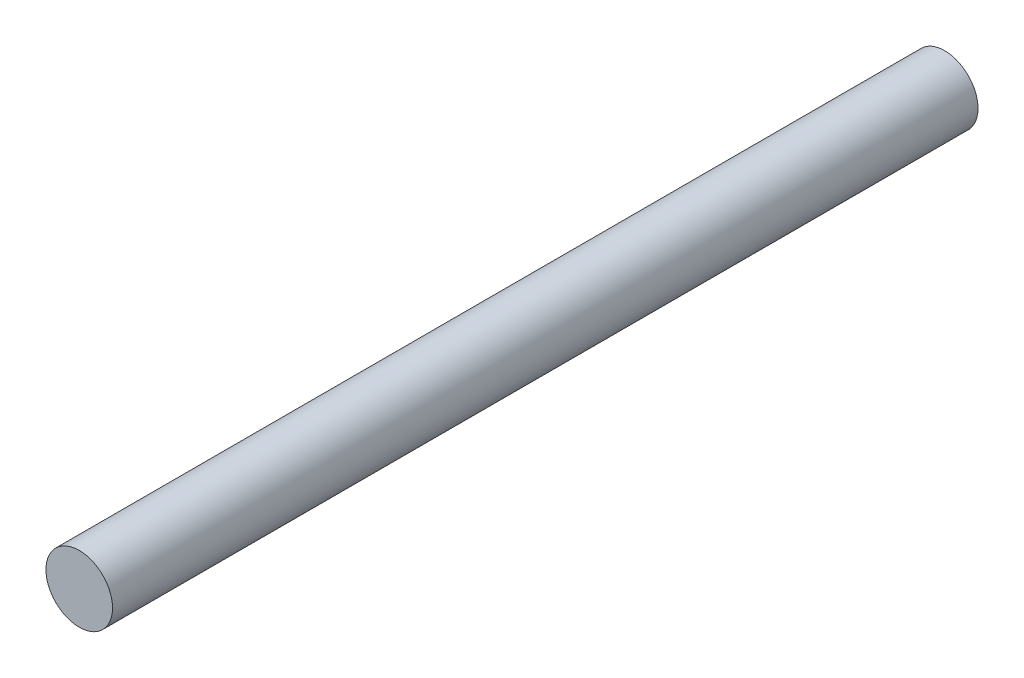
from build123d import *

# Parameters (mm, degrees)
ESQUISSE2_R        = 3
BOSS_EXTRU_1_DEPTH = 78


with BuildPart() as part:
    # Esquisse2 → Boss.-Extru.1 (new body)
    with BuildSketch(Plane.XY):
        Circle(ESQUISSE2_R)
    extrude(amount=BOSS_EXTRU_1_DEPTH)


solid = part.part
